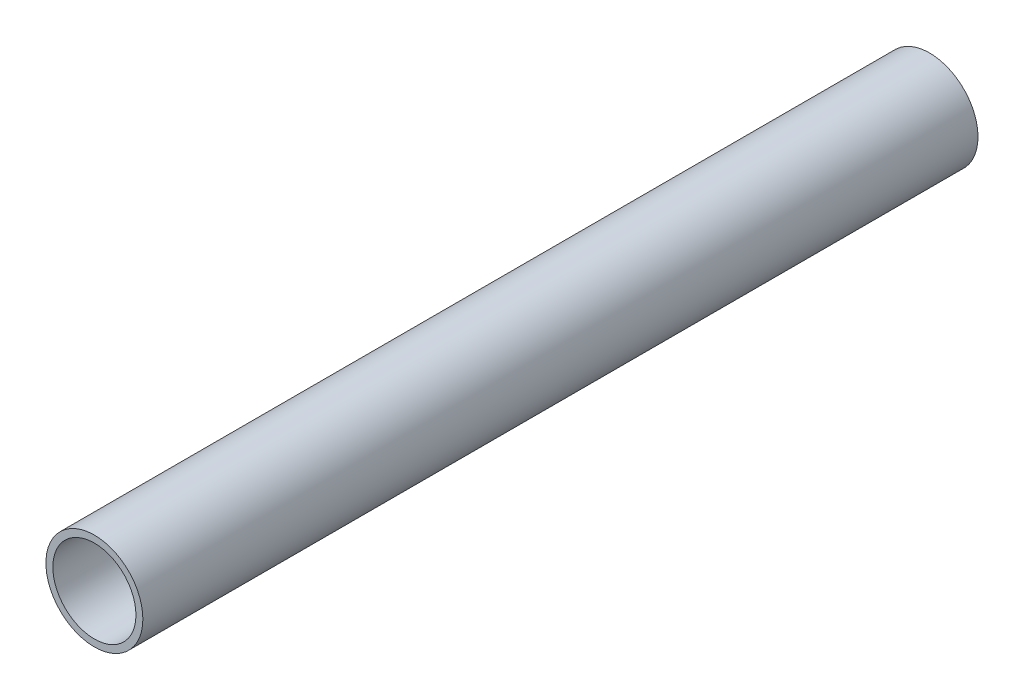
from build123d import *

# Parameters (mm, degrees)
SKETCH1_R           = 11.1125
SKETCH1_R_2         = 9.525
BOSS_EXTRUDE1_DEPTH = 95.717017989


with BuildPart() as part:
    # Sketch1 → Boss-Extrude1 (new, symmetric)
    with BuildSketch(Plane.XY):
        Circle(SKETCH1_R)
        Circle(SKETCH1_R_2, mode=Mode.SUBTRACT)
    extrude(amount=BOSS_EXTRUDE1_DEPTH, both=True)


solid = part.part
